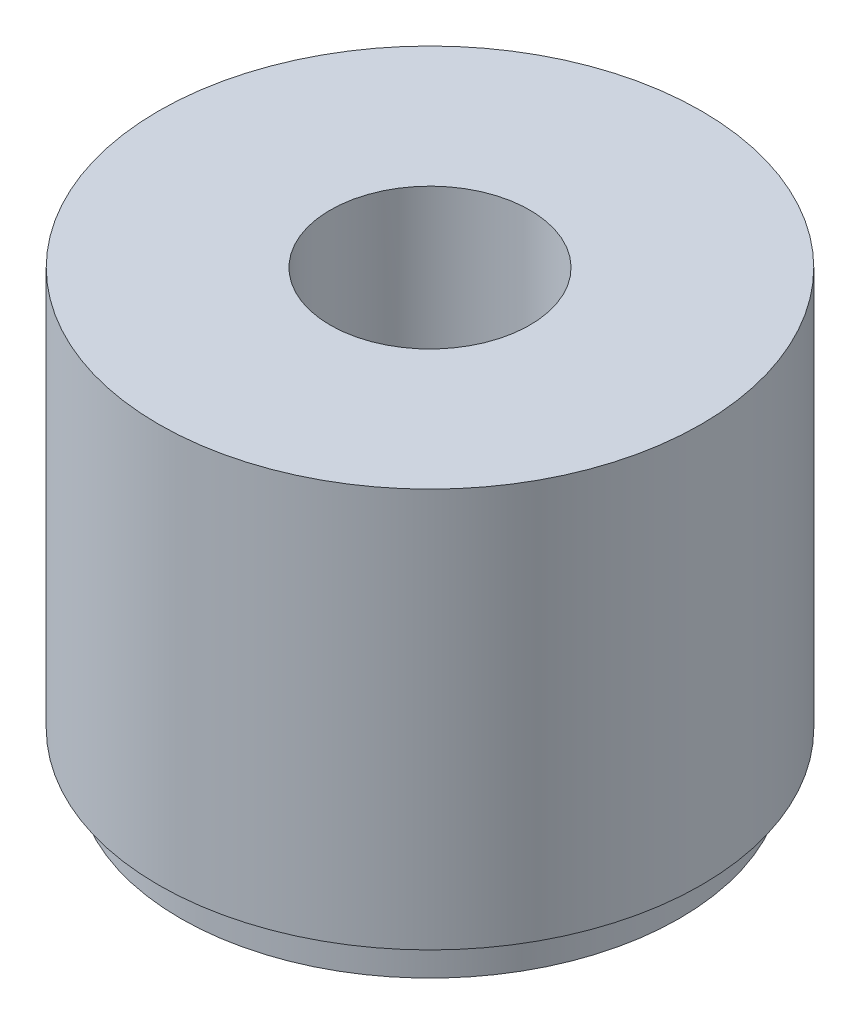
from build123d import *
from build123d.topology import SkipClean

# Parameters (mm, degrees)
SKETCH_2_R      = 6.25
SKETCH_2_R_2    = 2.5
EXTRUDE_1_DEPTH = 1
EXTRUDE_START   = 10
SKETCH_3_R      = 6.8
SKETCH_3_R_2    = 2.5
EXTRUDE_2_DEPTH = 10


with BuildPart() as part:
    # Эскиз2 → Бобышка-Вытянуть1 (new body)
    with BuildSketch(Plane.XZ.offset(0.531623013)):
        with Locations(Location((-0.920226727, 0.211554027, 0), (0, 0, 270))):
            Circle(SKETCH_2_R)
        with Locations(Location((-0.920226727, 0.211554027, 0), (0, 0, 270))):
            Circle(SKETCH_2_R_2, mode=Mode.SUBTRACT)
    extrude(amount=EXTRUDE_1_DEPTH)

    # Эскиз3 → Бобышка-Вытянуть2 (add)
    with SkipClean():  # the faces are left unmerged after this step: merging them gives an invalid solid
        with BuildSketch(Plane(origin=(0, -0.531623013, 0), x_dir=(1, 0, 0), z_dir=(0, 1, 0)).offset(EXTRUDE_START)):
            with Locations(Location((-0.920226727, -0.211554027, 0), (0, 0, 270))):
                Circle(SKETCH_3_R)
            with Locations(Location((-0.920226727, -0.211554027, 0), (0, 0, 270))):
                Circle(SKETCH_3_R_2, mode=Mode.SUBTRACT)
        extrude(amount=-EXTRUDE_2_DEPTH)


solid = part.part
